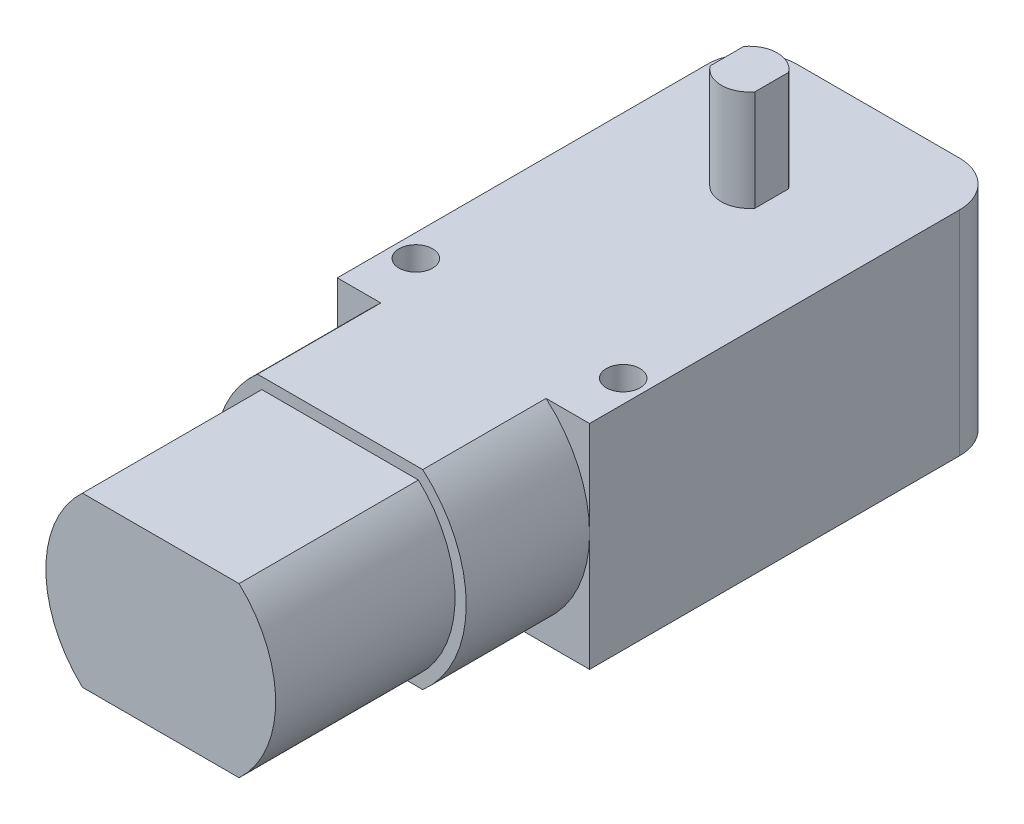
from build123d import *

# Parameters (mm, degrees)
SKETCH1_W           = 22.5
SKETCH1_H           = 19
BOSS_EXTRUDE1_DEPTH = 37
BOSS_EXTRUDE2_DEPTH = 11
BOSS_EXTRUDE3_DEPTH = 16
FILLET1_R           = 4
SKETCH6_W           = 5
SKETCH6_H           = 2.5
BOSS_EXTRUDE4_DEPTH = 5
SKETCH7_R           = 1.5
CUT_EXTRUDE1_DEPTH  = 5
SKETCH5_R           = 1.5
CUT_EXTRUDE3_DEPTH  = 19
BOSS_EXTRUDE5_DEPTH = 9
BOSS_EXTRUDE6_START = 9
BOSS_EXTRUDE6_DEPTH = 9


with BuildPart() as part:
    # Sketch1 → Boss-Extrude1 (new body)
    with BuildSketch(Plane.XY):
        Rectangle(SKETCH1_W, SKETCH1_H)
    extrude(amount=BOSS_EXTRUDE1_DEPTH)

    # Sketch3 → Boss-Extrude2 (add)
    with BuildSketch(Plane.XY.offset(37)):
        with BuildLine():
            ThreePointArc((-7.369701486, 9.5), (-11.25, 1), (-7.369701486, -7.5))
            Line((-7.369701486, -7.5), (7.369701486, -7.5))
            ThreePointArc((7.369701486, -7.5), (11.25, 1), (7.369701486, 9.5))
            Line((7.369701486, 9.5), (-7.369701486, 9.5))
        make_face()
    extrude(amount=BOSS_EXTRUDE2_DEPTH)

    # Sketch4 → Boss-Extrude3 (add)
    with BuildSketch(Plane.XY.offset(48)):
        with BuildLine():
            Line((5.23171695, 8.5), (-2.076174526, 8.5))
            Line((-2.076174526, 8.5), (-6.986594306, 8.5))
            ThreePointArc((-6.986594306, 8.5), (-10.25, 1), (-6.986594306, -6.5))
            Line((-6.986594306, -6.5), (-5.941237129, -6.5))
            Line((-5.941237129, -6.5), (4.647085632, -6.5))
            Line((4.647085632, -6.5), (6.986594306, -6.5))
            ThreePointArc((6.986594306, -6.5), (10.25, 1), (6.986594306, 8.5))
            Line((6.986594306, 8.5), (5.23171695, 8.5))
        make_face()
    extrude(amount=BOSS_EXTRUDE3_DEPTH)

    # Fillet1
    fillet1_edges = [part.edges().sort_by_distance(p)[0] for p in [
        (11.25, 0, 0),
        (-11.25, 0, 0),
    ]]
    fillet(fillet1_edges, radius=FILLET1_R)

    # Sketch6 → Boss-Extrude4 (add)
    with BuildSketch(Plane(origin=(0, 0, 0), x_dir=(-1, 0, 0), z_dir=(0, 0, -1))):
        with Locations((0.019167068, 0.75)):
            Rectangle(SKETCH6_W, SKETCH6_H)
    extrude(amount=BOSS_EXTRUDE4_DEPTH)

    # Sketch7 → Cut-Extrude1 (cut)
    with BuildSketch(Plane(origin=(0, 2, 0), x_dir=(1, 0, 0), z_dir=(0, 1, 0))):
        with Locations((-0.009583534, 2.5)):
            Circle(SKETCH7_R)
    extrude(amount=-CUT_EXTRUDE1_DEPTH, mode=Mode.SUBTRACT)

    # Sketch5 → Cut-Extrude3 (cut)
    with BuildSketch(Plane(origin=(0, 9.5, 0), x_dir=(1, 0, 0), z_dir=(0, 1, 0))):
        with Locations((-9.25, -32)):
            Circle(SKETCH5_R)
        with Locations((9.25, -32)):
            Circle(SKETCH5_R)
    extrude(amount=-CUT_EXTRUDE3_DEPTH, mode=Mode.SUBTRACT)

    # Sketch5<5> → Boss-Extrude5 (add)
    with BuildSketch(Plane(origin=(0, 9.5, 0), x_dir=(1, 0, 0), z_dir=(0, 1, 0))):
        with BuildLine():
            Line((-2, -10), (-2, -13))
            ThreePointArc((-2, -13), (0, -14), (2, -13))
            Line((2, -13), (2, -10))
            ThreePointArc((2, -10), (0, -9), (-2, -10))
        make_face()
    extrude(amount=BOSS_EXTRUDE5_DEPTH)

    # Sketch8 → Boss-Extrude6 (add)
    with BuildSketch(Plane.XZ.offset(9.5).offset(BOSS_EXTRUDE6_START)):
        with BuildLine():
            Line((-2, 13), (-2, 10))
            ThreePointArc((-2, 10), (0, 9), (2, 10))
            Line((2, 10), (2, 13))
            ThreePointArc((2, 13), (0, 14), (-2, 13))
        make_face()
    extrude(amount=-BOSS_EXTRUDE6_DEPTH)


solid = part.part
